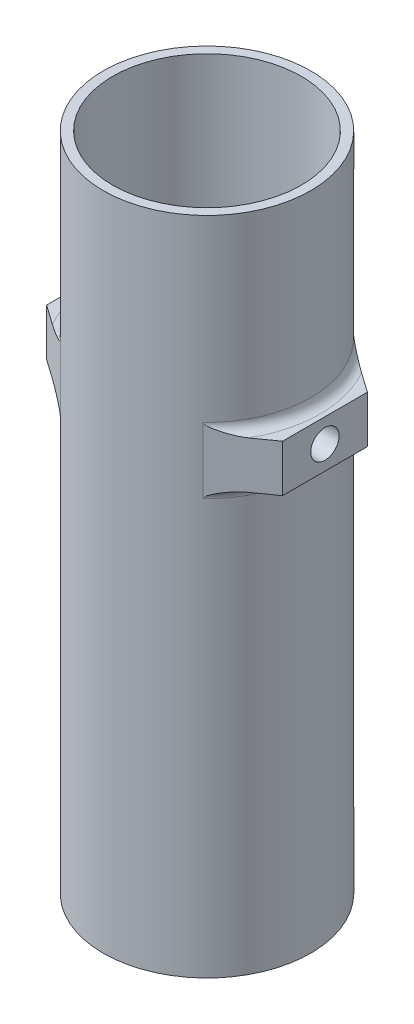
from build123d import *

# Parameters (mm, degrees)
CROQUIS1_R                 = 11
CROQUIS1_R_2               = 10
SALIENTE_EXTRUIR1_DEPTH    = 70
SALIENTE_EXTRUIR2_START    = -5
SALIENTE_EXTRUIR2_DEPTH    = 5
CORTAR_EXTRUIR1_DEPTH      = 76.139869577
CORTAR_EXTRUIR1_DEPTH_BACK = 76.139869577
REDONDEO1_R                = 1
SALIENTE_EXTRUIR3_START    = -10.5
CROQUIS4_R                 = 2.5
CROQUIS4_R_2               = 1.5
SALIENTE_EXTRUIR3_DEPTH    = 1.4


with BuildPart() as part:
    # Croquis1 → Saliente-Extruir1 (new body)
    with BuildSketch(Plane(origin=(0, 0, 0), x_dir=(1, 0, 0), z_dir=(0, 1, 0))):
        with Locations(Location((0, 0, 0), (0, 0, 270))):
            Circle(CROQUIS1_R)
        with Locations(Location((0, 0, 0), (0, 0, 270))):
            Circle(CROQUIS1_R_2, mode=Mode.SUBTRACT)
    extrude(amount=SALIENTE_EXTRUIR1_DEPTH)

    # Croquis2 → Saliente-Extruir2 (add)
    with BuildSketch(Plane(origin=(0, 50, 0), x_dir=(1, 0, 0), z_dir=(0, 1, 0)).offset(SALIENTE_EXTRUIR2_START)):
        with BuildLine():
            Line((-12.5, 4.5), (-12.5, -4.5))
            Line((-12.5, -4.5), (-7.570478535, -7.980467076))
            ThreePointArc((-7.570478535, -7.980467076), (-11, 0), (-7.570478535, 7.980467076))
            Line((-7.570478535, 7.980467076), (-12.5, 4.5))
        make_face()
        with BuildLine():
            Line((12.5, -4.5), (12.5, 4.5))
            Line((12.5, 4.5), (7.570478535, 7.980467076))
            ThreePointArc((7.570478535, 7.980467076), (11, 0), (7.570478535, -7.980467076))
            Line((7.570478535, -7.980467076), (12.5, -4.5))
        make_face()
    extrude(amount=SALIENTE_EXTRUIR2_DEPTH)

    # Croquis3 → Cortar-Extruir1 (cut, two sides: drawn at the far end of the back side and taken through both)
    with BuildSketch(Plane.ZY.offset(12.5).offset(-CORTAR_EXTRUIR1_DEPTH_BACK)):
        with BuildLine():
            ThreePointArc((0, 49), (-1.5, 47.5), (0, 46))
            Line((0, 46), (0, 49))
        make_face()
        with BuildLine():
            Line((0, 49), (0, 46))
            ThreePointArc((0, 46), (1.060660172, 46.439339828), (1.5, 47.5))
            ThreePointArc((1.5, 47.5), (1.060660172, 48.560660172), (0, 49))
        make_face()
    extrude(amount=CORTAR_EXTRUIR1_DEPTH + CORTAR_EXTRUIR1_DEPTH_BACK, mode=Mode.SUBTRACT)

    # Redondeo1
    redondeo1_edges = [part.edges().sort_by_distance(p)[0] for p in [
        (-11, 50, 0),
        (-11, 45, 0),
        (11, 45, 0),
        (11, 50, 0),
    ]]
    fillet(redondeo1_edges, radius=REDONDEO1_R)

    # Croquis4 → Saliente-Extruir3 (add)
    with BuildSketch(Plane(origin=(0, 0, 0), x_dir=(0, 0, -1), z_dir=(1, 0, 0)).offset(SALIENTE_EXTRUIR3_START)):
        with Locations((0, 66.5)):
            Circle(CROQUIS4_R)
        with Locations((0, 66.5)):
            Circle(CROQUIS4_R_2, mode=Mode.SUBTRACT)
    extrude(amount=-SALIENTE_EXTRUIR3_DEPTH)


solid = part.part
